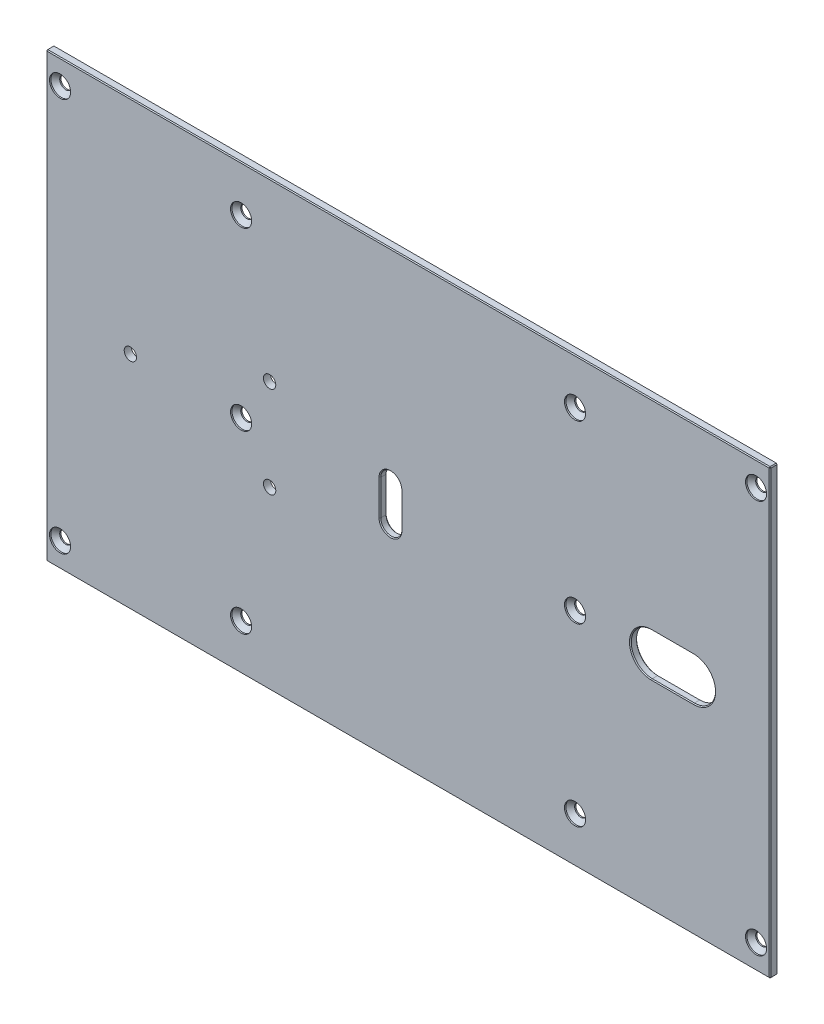
from build123d import *

# Parameters (mm, degrees)
SKETCH1_W                                      = 206
SKETCH1_H                                      = 126
SKETCH1_R                                      = 1.75
BOSS_EXTRUDE1_DEPTH                            = 2
CUT_EXTRUDE1_REACH                             = 217.55
SKETCH2_R                                      = 1.75
CUT_EXTRUDE2_REACH                             = 217.55
CSK_FOR_M3_FLAT_HEAD_MACHINE_SCREW1_AT_2_COUNT = 2
CSK_FOR_M3_FLAT_HEAD_MACHINE_SCREW1_AT_2_PITCH = 51.848336521
CSK_FOR_M3_FLAT_HEAD_MACHINE_SCREW1_AT_3_COUNT = 2
CSK_FOR_M3_FLAT_HEAD_MACHINE_SCREW1_AT_3_PITCH = 76.08054942
CSK_FOR_M3_FLAT_HEAD_MACHINE_SCREW1_AT_4_COUNT = 2
CSK_FOR_M3_FLAT_HEAD_MACHINE_SCREW1_AT_4_PITCH = 117.848419591
CSK_FOR_M3_FLAT_HEAD_MACHINE_SCREW1_AT_5_COUNT = 2
CSK_FOR_M3_FLAT_HEAD_MACHINE_SCREW1_AT_5_PITCH = 112
CSK_FOR_M3_FLAT_HEAD_MACHINE_SCREW1_AT_6_COUNT = 2
CSK_FOR_M3_FLAT_HEAD_MACHINE_SCREW1_AT_6_PITCH = 146.622815414
CSK_FOR_M3_FLAT_HEAD_MACHINE_SCREW1_AT_7_COUNT = 2
CSK_FOR_M3_FLAT_HEAD_MACHINE_SCREW1_AT_7_PITCH = 198
CSK_FOR_M3_FLAT_HEAD_MACHINE_SCREW1_AT_8_COUNT = 2
CSK_FOR_M3_FLAT_HEAD_MACHINE_SCREW1_AT_8_PITCH = 227.481867409
CSK_FOR_M3_FLAT_HEAD_MACHINE_SCREW1_AT_9_COUNT = 2
CSK_FOR_M3_FLAT_HEAD_MACHINE_SCREW1_AT_9_PITCH = 156.838292518
CSK_FOR_M3_FLAT_HEAD_MACHINE_SCREW1_AT_1_COUNT = 2
CSK_FOR_M3_FLAT_HEAD_MACHINE_SCREW1_AT_1_PITCH = 180.826574374
CHAMFER1_SIZE                                  = 0.25


with BuildPart() as part:
    # Sketch1 → Boss-Extrude1 (new body)
    with BuildSketch(Plane.XY):
        with Locations((74, -60)):
            Rectangle(SKETCH1_W, SKETCH1_H)
        with Locations((-25, -4)):
            Circle(SKETCH1_R, mode=Mode.SUBTRACT)
        with Locations((26.5, -10)):
            Circle(SKETCH1_R, mode=Mode.SUBTRACT)
        with Locations((121.5, -10)):
            Circle(SKETCH1_R, mode=Mode.SUBTRACT)
        with Locations((173, -4)):
            Circle(SKETCH1_R, mode=Mode.SUBTRACT)
        with Locations((173, -116)):
            Circle(SKETCH1_R, mode=Mode.SUBTRACT)
        with Locations((121.5, -60)):
            Circle(SKETCH1_R, mode=Mode.SUBTRACT)
        with Locations((121.5, -110)):
            Circle(SKETCH1_R, mode=Mode.SUBTRACT)
        with Locations((26.5, -110)):
            Circle(SKETCH1_R, mode=Mode.SUBTRACT)
        with Locations((26.5, -60)):
            Circle(SKETCH1_R, mode=Mode.SUBTRACT)
        with Locations((-25, -116)):
            Circle(SKETCH1_R, mode=Mode.SUBTRACT)
    extrude(amount=BOSS_EXTRUDE1_DEPTH)

    # Sketch2 → Cut-Extrude1 (cut, up to next)
    with BuildSketch(Plane.XY.offset(2), mode=Mode.PRIVATE) as cut_extrude1_sk1:
        with Locations((34.621837413, -47)):
            Circle(SKETCH2_R)
    cut_extrude1_tool1 = extrude(cut_extrude1_sk1.sketch, amount=-CUT_EXTRUDE1_REACH, mode=Mode.PRIVATE) & part.part
    # Sketch2 → Cut-Extrude1 (cut, up to next)
    with BuildSketch(Plane.XY.offset(2), mode=Mode.PRIVATE) as cut_extrude1_sk2:
        with Locations((34.621837413, -73)):
            Circle(SKETCH2_R)
    cut_extrude1_tool2 = extrude(cut_extrude1_sk2.sketch, amount=-CUT_EXTRUDE1_REACH, mode=Mode.PRIVATE) & part.part
    # Sketch2 → Cut-Extrude1 (cut, up to next)
    with BuildSketch(Plane.XY.offset(2), mode=Mode.PRIVATE) as cut_extrude1_sk3:
        with Locations((-5, -60)):
            Circle(SKETCH2_R)
    cut_extrude1_tool3 = extrude(cut_extrude1_sk3.sketch, amount=-CUT_EXTRUDE1_REACH, mode=Mode.PRIVATE) & part.part
    add(cut_extrude1_tool1.solids().sort_by_distance((34.621837, -47, 2))[0], mode=Mode.SUBTRACT)
    add(cut_extrude1_tool2.solids().sort_by_distance((34.621837, -73, 2))[0], mode=Mode.SUBTRACT)
    add(cut_extrude1_tool3.solids().sort_by_distance((-5, -60, 2))[0], mode=Mode.SUBTRACT)

    # Sketch7 → Cut-Extrude2 (cut, up to next)
    with BuildSketch(Plane.XY.offset(2), mode=Mode.PRIVATE) as cut_extrude2_sk1:
        with BuildLine():
            Line((72, -55), (72, -65))
            ThreePointArc((72, -65), (69, -68), (66, -65))
            Line((66, -65), (66, -55))
            ThreePointArc((66, -55), (69, -52), (72, -55))
        make_face()
    cut_extrude2_tool1 = extrude(cut_extrude2_sk1.sketch, amount=-CUT_EXTRUDE2_REACH, mode=Mode.PRIVATE) & part.part
    # Sketch7 → Cut-Extrude2 (cut, up to next)
    with BuildSketch(Plane.XY.offset(2), mode=Mode.PRIVATE) as cut_extrude2_sk2:
        with BuildLine():
            Line((143.25, -54), (155.25, -54))
            ThreePointArc((155.25, -54), (161.25, -60), (155.25, -66))
            Line((155.25, -66), (143.25, -66))
            ThreePointArc((143.25, -66), (137.25, -60), (143.25, -54))
        make_face()
    cut_extrude2_tool2 = extrude(cut_extrude2_sk2.sketch, amount=-CUT_EXTRUDE2_REACH, mode=Mode.PRIVATE) & part.part
    add(cut_extrude2_tool1.solids().sort_by_distance((69, -60, 2))[0], mode=Mode.SUBTRACT)
    add(cut_extrude2_tool2.solids().sort_by_distance((149.25, -60, 2))[0], mode=Mode.SUBTRACT)

    # Sketch4 → CSK for M3 Flat Head Machine Screw1 (revolve, cut)
    with BuildSketch(Plane(origin=(-25, -4, 2), x_dir=(0, -1, 0), z_dir=(1, 0, 0))):
        Polygon((0, 0), (0, 2), (1.75, 2), (1.75, 1.65), (3, 0.4), (3, 0), align=None)
    csk_for_m3_flat_head_machine_screw1 = revolve(axis=Axis((-25, -4, 8.35), (0, 0, -1)), mode=Mode.SUBTRACT)

    # CSK for M3 Flat Head Machine Screw1 at 2: CSK for M3 Flat Head Machine Screw1 ×2
    with Locations(*[Vector(0.9932816259031161, -0.11572213117317788, 0) * (i * CSK_FOR_M3_FLAT_HEAD_MACHINE_SCREW1_AT_2_PITCH) for i in range(1, CSK_FOR_M3_FLAT_HEAD_MACHINE_SCREW1_AT_2_COUNT)]):
        add(csk_for_m3_flat_head_machine_screw1, mode=Mode.SUBTRACT)

    # CSK for M3 Flat Head Machine Screw1 at 3: CSK for M3 Flat Head Machine Screw1 ×2
    with Locations(*[Vector(0.6769141441909728, -0.7360619820329011, 0) * (i * CSK_FOR_M3_FLAT_HEAD_MACHINE_SCREW1_AT_3_PITCH) for i in range(1, CSK_FOR_M3_FLAT_HEAD_MACHINE_SCREW1_AT_3_COUNT)]):
        add(csk_for_m3_flat_head_machine_screw1, mode=Mode.SUBTRACT)

    # CSK for M3 Flat Head Machine Screw1 at 4: CSK for M3 Flat Head Machine Screw1 ×2
    with Locations(*[Vector(0.4370020419358412, -0.8994605134990115, 0) * (i * CSK_FOR_M3_FLAT_HEAD_MACHINE_SCREW1_AT_4_PITCH) for i in range(1, CSK_FOR_M3_FLAT_HEAD_MACHINE_SCREW1_AT_4_COUNT)]):
        add(csk_for_m3_flat_head_machine_screw1, mode=Mode.SUBTRACT)

    # CSK for M3 Flat Head Machine Screw1 at 5: CSK for M3 Flat Head Machine Screw1 ×2
    with Locations(*[(0, -i * CSK_FOR_M3_FLAT_HEAD_MACHINE_SCREW1_AT_5_PITCH, 0) for i in range(1, CSK_FOR_M3_FLAT_HEAD_MACHINE_SCREW1_AT_5_COUNT)]):
        add(csk_for_m3_flat_head_machine_screw1, mode=Mode.SUBTRACT)

    # CSK for M3 Flat Head Machine Screw1 at 6: CSK for M3 Flat Head Machine Screw1 ×2
    with Locations(*[Vector(0.9991623717366304, -0.04092132580491247, 0) * (i * CSK_FOR_M3_FLAT_HEAD_MACHINE_SCREW1_AT_6_PITCH) for i in range(1, CSK_FOR_M3_FLAT_HEAD_MACHINE_SCREW1_AT_6_COUNT)]):
        add(csk_for_m3_flat_head_machine_screw1, mode=Mode.SUBTRACT)

    # CSK for M3 Flat Head Machine Screw1 at 7: CSK for M3 Flat Head Machine Screw1 ×2
    with Locations(*[(i * CSK_FOR_M3_FLAT_HEAD_MACHINE_SCREW1_AT_7_PITCH, 0, 0) for i in range(1, CSK_FOR_M3_FLAT_HEAD_MACHINE_SCREW1_AT_7_COUNT)]):
        add(csk_for_m3_flat_head_machine_screw1, mode=Mode.SUBTRACT)

    # CSK for M3 Flat Head Machine Screw1 at 8: CSK for M3 Flat Head Machine Screw1 ×2
    with Locations(*[Vector(0.8703990443501523, -0.4923469341778639, 0) * (i * CSK_FOR_M3_FLAT_HEAD_MACHINE_SCREW1_AT_8_PITCH) for i in range(1, CSK_FOR_M3_FLAT_HEAD_MACHINE_SCREW1_AT_8_COUNT)]):
        add(csk_for_m3_flat_head_machine_screw1, mode=Mode.SUBTRACT)

    # CSK for M3 Flat Head Machine Screw1 at 9: CSK for M3 Flat Head Machine Screw1 ×2
    with Locations(*[Vector(0.934083109729549, -0.3570556596918405, 0) * (i * CSK_FOR_M3_FLAT_HEAD_MACHINE_SCREW1_AT_9_PITCH) for i in range(1, CSK_FOR_M3_FLAT_HEAD_MACHINE_SCREW1_AT_9_COUNT)]):
        add(csk_for_m3_flat_head_machine_screw1, mode=Mode.SUBTRACT)

    # CSK for M3 Flat Head Machine Screw1 at 1: CSK for M3 Flat Head Machine Screw1 ×2
    with Locations(*[Vector(0.8101685302992528, -0.5861970253359775, 0) * (i * CSK_FOR_M3_FLAT_HEAD_MACHINE_SCREW1_AT_1_PITCH) for i in range(1, CSK_FOR_M3_FLAT_HEAD_MACHINE_SCREW1_AT_1_COUNT)]):
        add(csk_for_m3_flat_head_machine_screw1, mode=Mode.SUBTRACT)

    # Chamfer1
    chamfer1_edges = [part.edges().sort_by_distance(p)[0] for p in [
        (177, -60, 2),
        (74, 3, 2),
        (-29, -60, 2),
        (-29, 3, 1),
        (177, 3, 1),
        (177, -123, 1),
        (-29, -123, 1),
        (69, -52, 2),
        (66, -60, 2),
        (69, -68, 2),
        (72, -60, 2),
        (66, -60, 0),
        (69, -52, 0),
        (72, -60, 0),
        (69, -68, 0),
        (137.25, -60, 2),
        (149.25, -66, 2),
        (161.25, -60, 2),
        (149.25, -54, 2),
        (149.25, -66, 0),
        (137.25, -60, 0),
        (149.25, -54, 0),
        (161.25, -60, 0),
        (74, -123, 2),
    ]]
    chamfer(chamfer1_edges, length=CHAMFER1_SIZE)


solid = part.part
